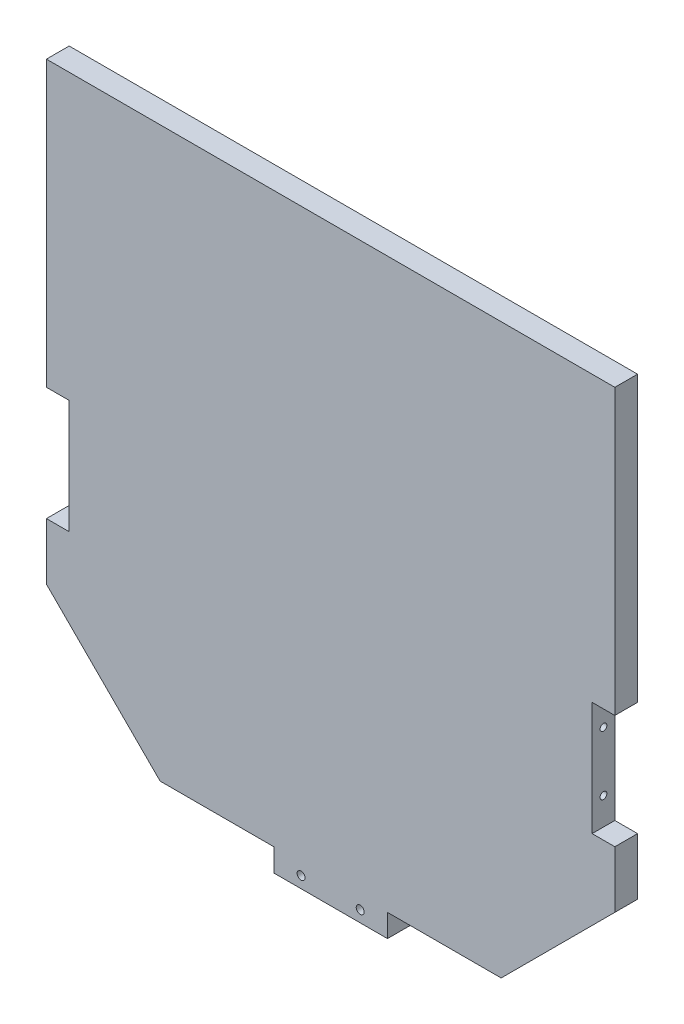
from build123d import *

# Parameters (mm, degrees)
SKETCH1_R           = 1.75
BOSS_EXTRUDE1_DEPTH = 10
SKETCH2_R           = 1.5
CUT_EXTRUDE1_DEPTH  = 15


with BuildPart() as part:
    # Sketch1 → Boss-Extrude1 (new body)
    with BuildSketch(Plane.XY):
        Polygon((-125, 75), (-125, 50), (-75, 0), (-25, 0), (-25, -10), (25, -10), (25, 0), (75, 0), (125, 50), (125, 75), (115, 75), (115, 125), (125, 125), (125, 250), (-125, 250), (-125, 125), (-115, 125), (-115, 75), align=None)
        with Locations((-13, -5)):
            Circle(SKETCH1_R, mode=Mode.SUBTRACT)
        with Locations((13, -5)):
            Circle(SKETCH1_R, mode=Mode.SUBTRACT)
    extrude(amount=BOSS_EXTRUDE1_DEPTH)

    # Sketch2 → Cut-Extrude1 (cut)
    with BuildSketch(Plane(origin=(115, 0, 0), x_dir=(0, 0, -1), z_dir=(1, 0, 0))):
        with Locations(Location((-5, 113, 0), (0, 0, 90))):
            Circle(SKETCH2_R)
        with Locations(Location((-5, 87, 0), (0, 0, 90))):
            Circle(SKETCH2_R)
    cut_extrude1 = extrude(amount=-CUT_EXTRUDE1_DEPTH, mode=Mode.SUBTRACT)

    # Mirror1: Cut-Extrude1 across plane
    add(cut_extrude1.mirror(Plane(origin=(0, 0, 0), x_dir=(0, 0, 1), z_dir=(1, 0, 0))), mode=Mode.SUBTRACT)


solid = part.part
